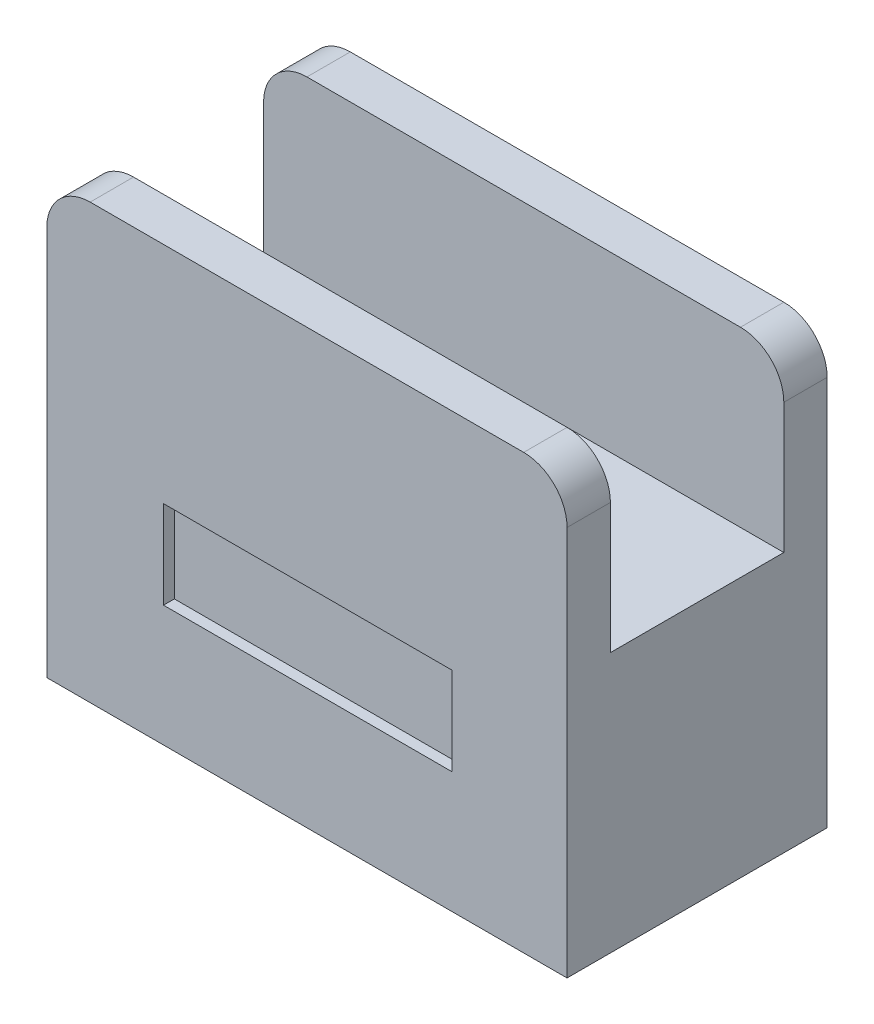
from build123d import *

# Parameters (mm, degrees)
SKETCH1_W           = 152.4
SKETCH1_H           = 76.2
BOSS_EXTRUDE1_DEPTH = 76.2
SKETCH2_W           = 152.4
SKETCH2_H           = 12.7
BOSS_EXTRUDE2_DEPTH = 50.8
FILLET1_R           = 12.7
SKETCH3_W           = 84.462045133
SKETCH3_H           = 25.769420555
CUT_EXTRUDE1_DEPTH  = 3.175


with BuildPart() as part:
    # Sketch1 → Boss-Extrude1 (new body)
    with BuildSketch(Plane.XY):
        with Locations((76.2, 38.1)):
            Rectangle(SKETCH1_W, SKETCH1_H)
    extrude(amount=BOSS_EXTRUDE1_DEPTH)

    # Sketch2 → Boss-Extrude2 (add)
    with BuildSketch(Plane(origin=(0, 76.2, 0), x_dir=(1, 0, 0), z_dir=(0, 1, 0))):
        with Locations((76.2, -6.35)):
            Rectangle(SKETCH2_W, SKETCH2_H)
    boss_extrude2 = extrude(amount=BOSS_EXTRUDE2_DEPTH)

    # Mirror1: Boss-Extrude2 across plane
    add(boss_extrude2.mirror(Plane.XY.offset(38.1)))

    # Fillet1
    fillet1_edges = [part.edges().sort_by_distance(p)[0] for p in [
        (0, 127, 6.35),
        (152.4, 127, 6.35),
        (0, 127, 69.85),
        (152.4, 127, 69.85),
    ]]
    fillet(fillet1_edges, radius=FILLET1_R)

    # Sketch3 → Cut-Extrude1 (cut)
    with BuildSketch(Plane.XY.offset(76.2)):
        with Locations((76.416893198, 48.36205359)):
            Rectangle(SKETCH3_W, SKETCH3_H)
    extrude(amount=-CUT_EXTRUDE1_DEPTH, mode=Mode.SUBTRACT)


solid = part.part
